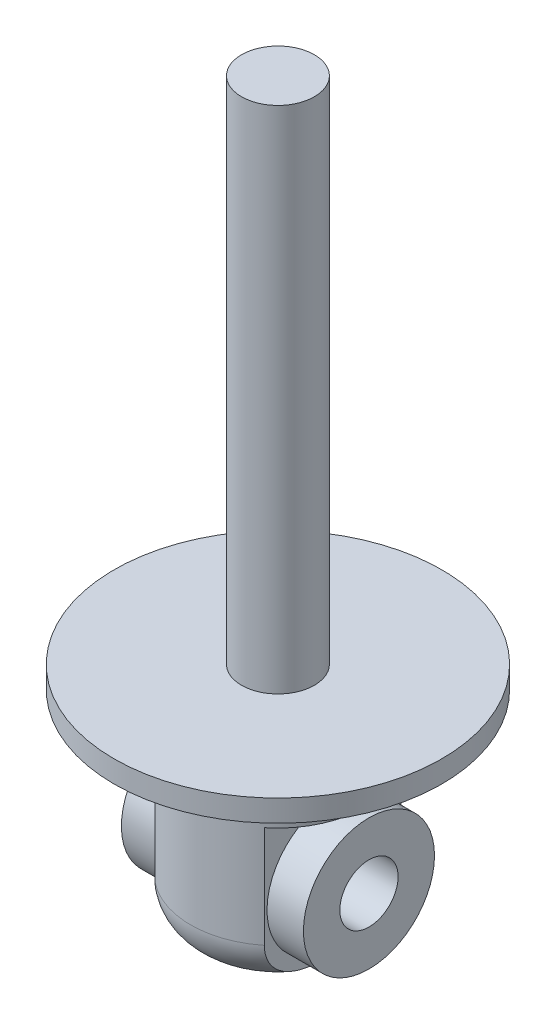
from build123d import *

# Parameters (mm, degrees)
SKETCH1_R               = 22.5
BOSS_EXTRUDE1_DEPTH     = 3
SKETCH2_R               = 5
BOSS_EXTRUDE2_DEPTH     = 70
SKETCH3_R               = 12
BOSS_EXTRUDE3_DEPTH     = 28
FILLET1_R               = 6
CUT_EXTRUDE1_DEPTH      = 80.633535649
CUT_EXTRUDE1_DEPTH_BACK = 80.633535649
SKETCH4_W               = 21.531161995
SKETCH4_H               = 20
CUT_EXTRUDE2_DEPTH      = 83.068568892
CUT_EXTRUDE2_DEPTH_BACK = 83.068568892
SKETCH5_R               = 4
BOSS_EXTRUDE7_START     = 5
SKETCH6_R               = 9
SKETCH6_R_2             = 4
BOSS_EXTRUDE7_DEPTH     = 5


with BuildPart() as part:
    # Sketch1 → Boss-Extrude1 (new body)
    with BuildSketch(Plane(origin=(0, 0, 0), x_dir=(1, 0, 0), z_dir=(0, 1, 0))):
        with Locations(Location((0, 0, 0), (0, 0, 270))):
            Circle(SKETCH1_R)
    extrude(amount=BOSS_EXTRUDE1_DEPTH)

    # Sketch2 → Boss-Extrude2 (add)
    with BuildSketch(Plane(origin=(0, 3, 0), x_dir=(1, 0, 0), z_dir=(0, 1, 0))):
        with Locations(Location((0, 0, 0), (0, 0, 270))):
            Circle(SKETCH2_R)
    extrude(amount=BOSS_EXTRUDE2_DEPTH)

    # Sketch3 → Boss-Extrude3 (add)
    with BuildSketch(Plane.XZ):
        with Locations(Location((0, 0, 0), (0, 0, 270))):
            Circle(SKETCH3_R)
    extrude(amount=BOSS_EXTRUDE3_DEPTH)

    # Fillet1
    fillet1_edges = [part.edges().sort_by_distance(p)[0] for p in [
        (0, -28, 12),
    ]]
    fillet(fillet1_edges, radius=FILLET1_R)

    # Sketch4 → Cut-Extrude1 (cut, two sides: drawn at the far end of the back side and taken through both)
    with BuildSketch(Plane.XY.offset(-CUT_EXTRUDE1_DEPTH_BACK)):
        with Locations((18.265580998, -18)):
            Rectangle(SKETCH4_W, SKETCH4_H)
        with Locations((-18.265580998, -18)):
            Rectangle(SKETCH4_W, SKETCH4_H)
    extrude(amount=CUT_EXTRUDE1_DEPTH + CUT_EXTRUDE1_DEPTH_BACK, mode=Mode.SUBTRACT)

    # Sketch5 → Cut-Extrude2 (cut, two sides: drawn at the far end of the back side and taken through both)
    with BuildSketch(Plane(origin=(7.5, 0, 0), x_dir=(0, 0, -1), z_dir=(1, 0, 0)).offset(-CUT_EXTRUDE2_DEPTH_BACK)):
        with Locations(Location((0, -18, 0), (0, 0, 90))):
            Circle(SKETCH5_R)
    extrude(amount=CUT_EXTRUDE2_DEPTH + CUT_EXTRUDE2_DEPTH_BACK, mode=Mode.SUBTRACT)

    # Sketch6 → Boss-Extrude7 (add)
    with BuildSketch(Plane(origin=(7.5, 0, 0), x_dir=(0, 0, -1), z_dir=(1, 0, 0)).offset(BOSS_EXTRUDE7_START)):
        with Locations(Location((0, -18, 0), (0, 0, 270))):
            Circle(SKETCH6_R)
        with Locations(Location((0, -18, 0), (0, 0, 90))):
            Circle(SKETCH6_R_2, mode=Mode.SUBTRACT)
    boss_extrude7 = extrude(amount=-BOSS_EXTRUDE7_DEPTH)

    # Mirror1: Boss-Extrude7 across plane
    add(boss_extrude7.mirror(Plane(origin=(0, 0, 0), x_dir=(0, 0, 1), z_dir=(1, 0, 0))))


solid = part.part
